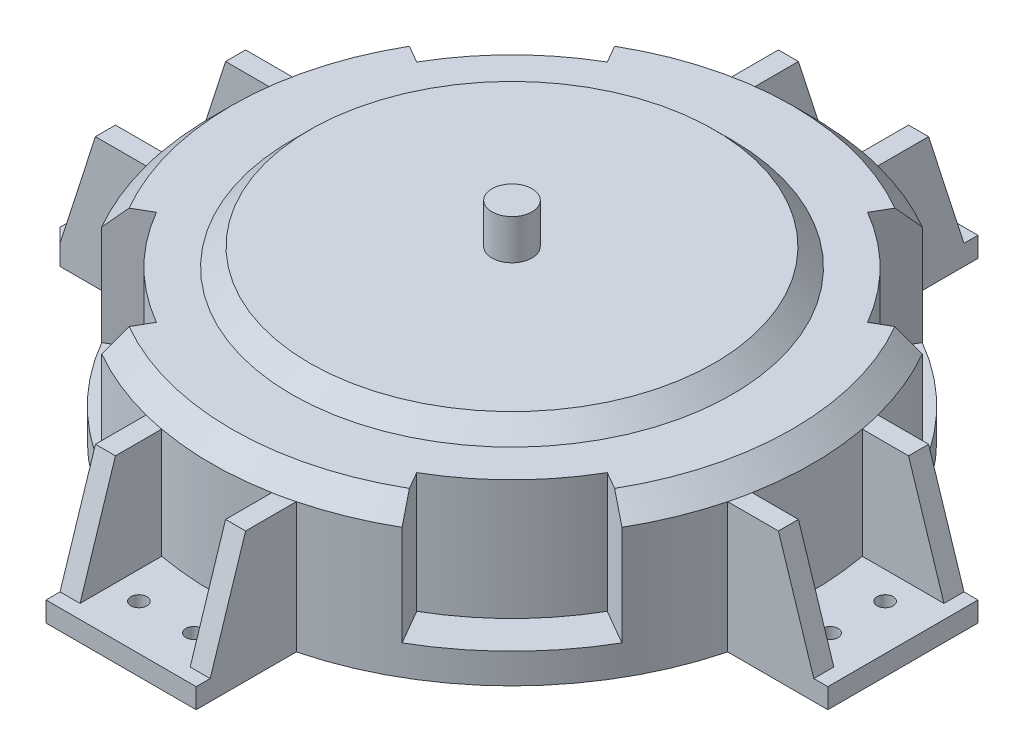
from build123d import *

# Parameters (mm, degrees)
SKETCH1_R                   = 150
BOSS_EXTRUDE1_DEPTH         = 75
CHAMFER1_SIZE               = 10
BOSS_EXTRUDE2_START         = -75
BOSS_EXTRUDE2_DEPTH         = 10
CHAMFER2_SIZE               = 7
BOSS_EXTRUDE3_DEPTH         = 10
SKETCH4_R                   = 4
CUT_EXTRUDE1_DEPTH          = 255.641782801
CIRPATTERN1_COUNT           = 4
CIRPATTERN1_COPY_1_DEPTH    = 10
CIRPATTERN1_COPY_2_DEPTH    = 10
CIRPATTERN1_COPY_3_DEPTH    = 10
CIRPATTERN1_COPY_4_SKETCH_R = 4
CIRPATTERN1_COPY_4_DEPTH    = 255.641782801
CIRPATTERN1_COPY_5_SKETCH_R = 4
CIRPATTERN1_COPY_5_DEPTH    = 255.641782801
CIRPATTERN1_COPY_6_SKETCH_R = 4
CIRPATTERN1_COPY_6_DEPTH    = 255.641782801
CUT_EXTRUDE2_START          = -60
CUT_EXTRUDE2_DEPTH          = 347.111647957
CIRPATTERN2_COUNT           = 4
SKETCH6_R                   = 110
BOSS_EXTRUDE4_DEPTH         = 9
BOSS_EXTRUDE4_TAPER         = 45
SKETCH7_R                   = 10
BOSS_EXTRUDE5_DEPTH         = 20
L_EK1_SCALE                 = 0.2


with BuildPart() as part:
    # Sketch1 → Boss-Extrude1 (new body)
    with BuildSketch(Plane(origin=(0, 0, 0), x_dir=(1, 0, 0), z_dir=(0, 1, 0))):
        with Locations(Location((0, 0, 0), (0, 0, 270))):
            Circle(SKETCH1_R)
    extrude(amount=BOSS_EXTRUDE1_DEPTH)

    # Chamfer1
    chamfer1_edges = [part.edges().sort_by_distance(p)[0] for p in [
        (0, 75, -150),
    ]]
    chamfer(chamfer1_edges, length=CHAMFER1_SIZE)

    # Sketch2 → Boss-Extrude2 (add)
    with BuildSketch(Plane(origin=(0, 75, 0), x_dir=(1, 0, 0), z_dir=(0, 1, 0)).offset(BOSS_EXTRUDE2_START)):
        with BuildLine():
            Line((-195.236875483, 37.5), (-195.236875483, -37.5))
            Line((-195.236875483, -37.5), (-145.236875483, -37.5))
            ThreePointArc((-145.236875483, -37.5), (-150, 0), (-145.236875483, 37.5))
            Line((-145.236875483, 37.5), (-195.236875483, 37.5))
        make_face()
    boss_extrude2 = extrude(amount=BOSS_EXTRUDE2_DEPTH)

    # Chamfer2
    chamfer2_edges = [part.edges().sort_by_distance(p)[0] for p in [
        (-195.236875483, 5, 37.5),
        (-195.236875483, 5, -37.5),
    ]]
    chamfer(chamfer2_edges, length=CHAMFER2_SIZE)

    # Sketch3 → Boss-Extrude3 (add)
    with BuildSketch(Plane.XY.offset(37.5)):
        Polygon((-150, 65), (-170.556875483, 65), (-188.236875483, 10), (-188.236875483, 0), (-145.236875483, 0), (-145.236875483, 65), align=None)
    boss_extrude3 = extrude(amount=-BOSS_EXTRUDE3_DEPTH)

    # Sketch4 → Cut-Extrude1 (cut, symmetric)
    with BuildSketch(Plane(origin=(0, 10, 0), x_dir=(1, 0, 0), z_dir=(0, 1, 0))):
        with Locations(Location((-172.618437741, -13.75, 0), (0, 0, 270))):
            Circle(SKETCH4_R)
    cut_extrude1 = extrude(amount=CUT_EXTRUDE1_DEPTH, both=True, mode=Mode.SUBTRACT)

    # Mirror1: Boss-Extrude3, Cut-Extrude1 across plane
    add(boss_extrude3.mirror(Plane.XY))
    add(cut_extrude1.mirror(Plane.XY), mode=Mode.SUBTRACT)

    # CirPattern1: Boss-Extrude2, Boss-Extrude3, Cut-Extrude1 ×4 about axis
    cirpattern1_axis = Axis((0, 0, 0), (0, 1, 0))
    add([boss_extrude2.rotate(cirpattern1_axis, i * 360 / CIRPATTERN1_COUNT) for i in range(1, CIRPATTERN1_COUNT)])
    add([boss_extrude3.rotate(cirpattern1_axis, i * 360 / CIRPATTERN1_COUNT) for i in range(1, CIRPATTERN1_COUNT)])
    add([cut_extrude1.rotate(cirpattern1_axis, i * 360 / CIRPATTERN1_COUNT) for i in range(1, CIRPATTERN1_COUNT)], mode=Mode.SUBTRACT)

    # CirPattern1 copy 1 sketch → CirPattern1 copy 1 (add)
    with BuildSketch(Plane(origin=(-37.5, 0, 0), x_dir=(0, 0, -1), z_dir=(-1, 0, 0))):
        Polygon((-150, -65), (-170.556875483, -65), (-188.236875483, -10), (-188.236875483, 0), (-145.236875483, 0), (-145.236875483, -65), align=None)
    extrude(amount=-CIRPATTERN1_COPY_1_DEPTH)

    # CirPattern1 copy 2 sketch → CirPattern1 copy 2 (add)
    with BuildSketch(Plane(origin=(0, 0, 37.5), x_dir=(-1, 0, 0), z_dir=(0, 0, 1))):
        Polygon((-150, -65), (-170.556875483, -65), (-188.236875483, -10), (-188.236875483, 0), (-145.236875483, 0), (-145.236875483, -65), align=None)
    extrude(amount=-CIRPATTERN1_COPY_2_DEPTH)

    # CirPattern1 copy 3 sketch → CirPattern1 copy 3 (add)
    with BuildSketch(Plane(origin=(37.5, 0, 0), x_dir=(0, 0, 1), z_dir=(1, 0, 0))):
        Polygon((-150, -65), (-170.556875483, -65), (-188.236875483, -10), (-188.236875483, 0), (-145.236875483, 0), (-145.236875483, -65), align=None)
    extrude(amount=-CIRPATTERN1_COPY_3_DEPTH)

    # CirPattern1 copy 4 sketch → CirPattern1 copy 4 (cut, symmetric)
    with BuildSketch(Plane(origin=(0, 10, 0), x_dir=(0, 0, -1), z_dir=(0, 1, 0))):
        with Locations((-172.618437741, 13.75)):
            Circle(CIRPATTERN1_COPY_4_SKETCH_R)
    extrude(amount=CIRPATTERN1_COPY_4_DEPTH, both=True, mode=Mode.SUBTRACT)

    # CirPattern1 copy 5 sketch → CirPattern1 copy 5 (cut, symmetric)
    with BuildSketch(Plane(origin=(0, 10, 0), x_dir=(-1, 0, 0), z_dir=(0, 1, 0))):
        with Locations((-172.618437741, 13.75)):
            Circle(CIRPATTERN1_COPY_5_SKETCH_R)
    extrude(amount=CIRPATTERN1_COPY_5_DEPTH, both=True, mode=Mode.SUBTRACT)

    # CirPattern1 copy 6 sketch → CirPattern1 copy 6 (cut, symmetric)
    with BuildSketch(Plane.ZX.offset(10)):
        with Locations((-172.618437741, 13.75)):
            Circle(CIRPATTERN1_COPY_6_SKETCH_R)
    extrude(amount=CIRPATTERN1_COPY_6_DEPTH, both=True, mode=Mode.SUBTRACT)

    # Sketch5 → Cut-Extrude2 (cut)
    with BuildSketch(Plane(origin=(0, 75, 0), x_dir=(1, 0, 0), z_dir=(0, 1, 0)).offset(CUT_EXTRUDE2_START)):
        with BuildLine():
            Line((-112.583302492, -65), (-129.903810568, -75))
            ThreePointArc((-129.903810568, -75), (-106.066017178, -106.066017178), (-75, -129.903810568))
            Line((-75, -129.903810568), (-65, -112.583302492))
            ThreePointArc((-65, -112.583302492), (-91.923881554, -91.923881554), (-112.583302492, -65))
        make_face()
    cut_extrude2 = extrude(amount=CUT_EXTRUDE2_DEPTH, mode=Mode.SUBTRACT)

    # CirPattern2: Cut-Extrude2 ×4 about axis
    cirpattern2_axis = Axis((0, 75, 0), (0, -1, 0))
    for i in range(1, CIRPATTERN2_COUNT):
        add(cut_extrude2.rotate(cirpattern2_axis, i * 360 / CIRPATTERN2_COUNT), mode=Mode.SUBTRACT)

    # Sketch6 → Boss-Extrude4 (add)
    with BuildSketch(Plane(origin=(0, 75, 0), x_dir=(1, 0, 0), z_dir=(0, 1, 0))):
        Circle(SKETCH6_R)
    extrude(amount=BOSS_EXTRUDE4_DEPTH, taper=BOSS_EXTRUDE4_TAPER)

    # Sketch7 → Boss-Extrude5 (add)
    with BuildSketch(Plane(origin=(0, 84, 0), x_dir=(1, 0, 0), z_dir=(0, 1, 0))):
        with Locations(Location((0, 0, 0), (0, 0, 270))):
            Circle(SKETCH7_R)
    extrude(amount=BOSS_EXTRUDE5_DEPTH)


with BuildPart() as part_1:
    # Ölçek1: scaled about (0.0171202, 38.41973145, 0)
    add(part.part.scale(L_EK1_SCALE).moved(Location((0.01369616, 30.73578516, 0))))


solid = part_1.part
